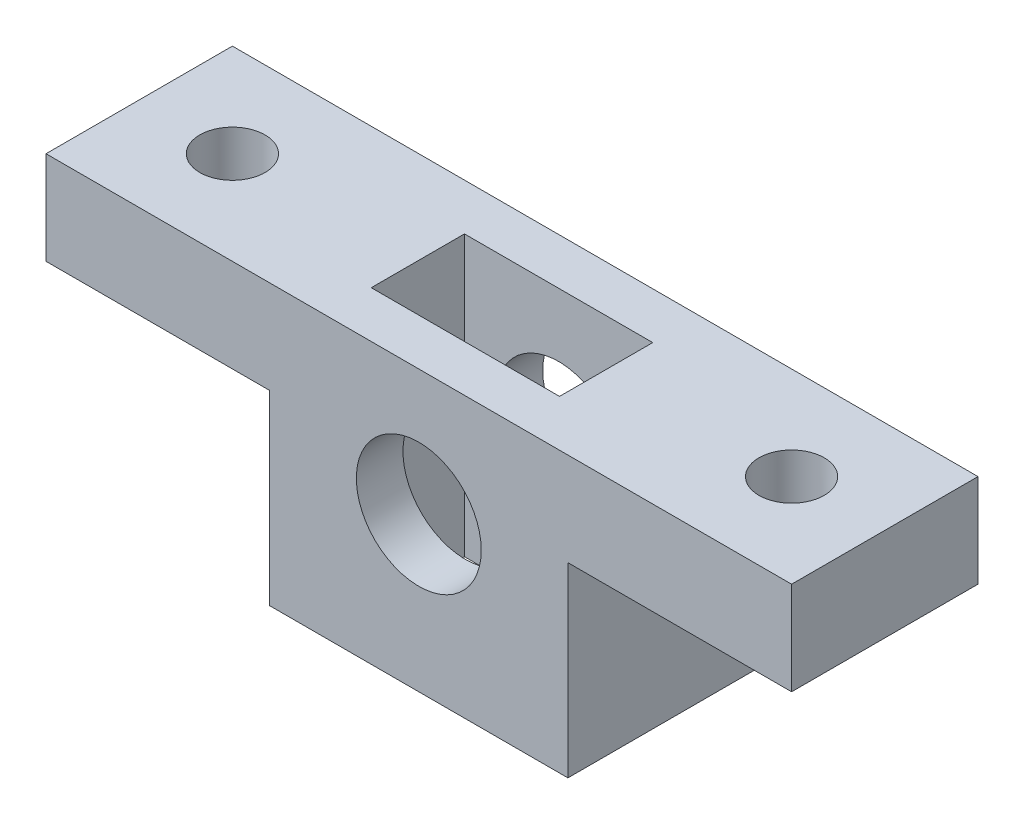
from build123d import *

# Parameters (mm, degrees)
ESBO_O1_R                = 3.35
RESSALTO_EXTRUS_O1_DEPTH = 10
ESBO_O2_R                = 1.75
CORTE_EXTRUS_O1_DEPTH    = 10
ESBO_O3_W                = 10.1
ESBO_O3_H                = 5
CORTE_EXTRUS_O2_DEPTH    = 20


with BuildPart() as part:
    # Esboço1 → Ressalto-extrusão1 (new body)
    with BuildSketch(Plane.XY):
        Polygon((-8, -5), (-8, -15), (8, -15), (8, -5), (20, -5), (20, 0), (-20, 0), (-20, -5), align=None)
        with Locations((0, -6.75)):
            Circle(ESBO_O1_R, mode=Mode.SUBTRACT)
    extrude(amount=RESSALTO_EXTRUS_O1_DEPTH)

    # Esboço2 → Corte-extrusão1 (cut)
    with BuildSketch(Plane(origin=(0, 0, 0), x_dir=(1, 0, 0), z_dir=(0, 1, 0))):
        with Locations(Location((-15, -5, 0), (0, 0, 180))):
            Circle(ESBO_O2_R)
        with Locations(Location((15, -5, 0), (0, 0, 180))):
            Circle(ESBO_O2_R)
    extrude(amount=-CORTE_EXTRUS_O1_DEPTH, mode=Mode.SUBTRACT)

    # Esboço3 → Corte-extrusão2 (cut)
    with BuildSketch(Plane.XZ.offset(15)):
        with Locations((0, 5)):
            Rectangle(ESBO_O3_W, ESBO_O3_H)
    extrude(amount=-CORTE_EXTRUS_O2_DEPTH, mode=Mode.SUBTRACT)


solid = part.part
